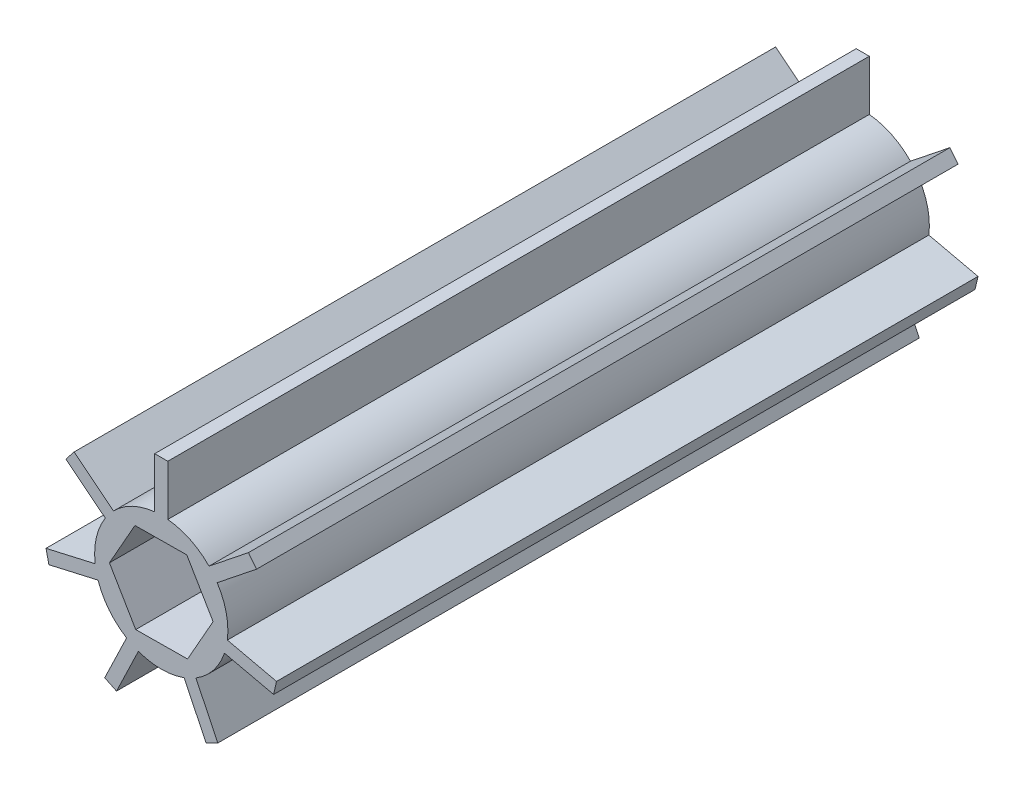
from build123d import *

# Parameters (mm, degrees)
BOSS_EXTRUDE1_DEPTH = 76.2
SKETCH6_R           = 7.239
BOSS_EXTRUDE2_DEPTH = 76.2
CIRPATTERN1_COUNT   = 7
CUT_EXTRUDE5_DEPTH  = 79.255893748


with BuildPart() as part:
    # Sketch12 → Boss-Extrude1 (new body)
    with BuildSketch(Plane.XY):
        Polygon((0, 0), (0.7112, 0), (0.7112, 12.680070763), (-0.7112, 12.680070763), (-0.7112, 0), align=None)
    boss_extrude1 = extrude(amount=-BOSS_EXTRUDE1_DEPTH)

    # Sketch6 → Boss-Extrude2 (add)
    with BuildSketch(Plane.XY):
        Circle(SKETCH6_R)
    extrude(amount=-BOSS_EXTRUDE2_DEPTH)

    # CirPattern1: Boss-Extrude1 ×7 about axis
    cirpattern1_axis = Axis((0, 0, -76.2), (0, 0, 1))
    for i in range(1, CIRPATTERN1_COUNT):
        add(boss_extrude1.rotate(cirpattern1_axis, i * 360 / CIRPATTERN1_COUNT))

    # Sketch8 → Cut-Extrude5 (cut, through all)
    with BuildSketch(Plane.XY):
        Polygon((5.6310401, 0.047871874), (2.774061791, 4.900559713), (-2.856978309, 4.852687839), (-5.6310401, -0.047871874), (-2.774061791, -4.900559713), (2.856978309, -4.852687839), align=None)
    extrude(amount=-CUT_EXTRUDE5_DEPTH, mode=Mode.SUBTRACT)


solid = part.part
